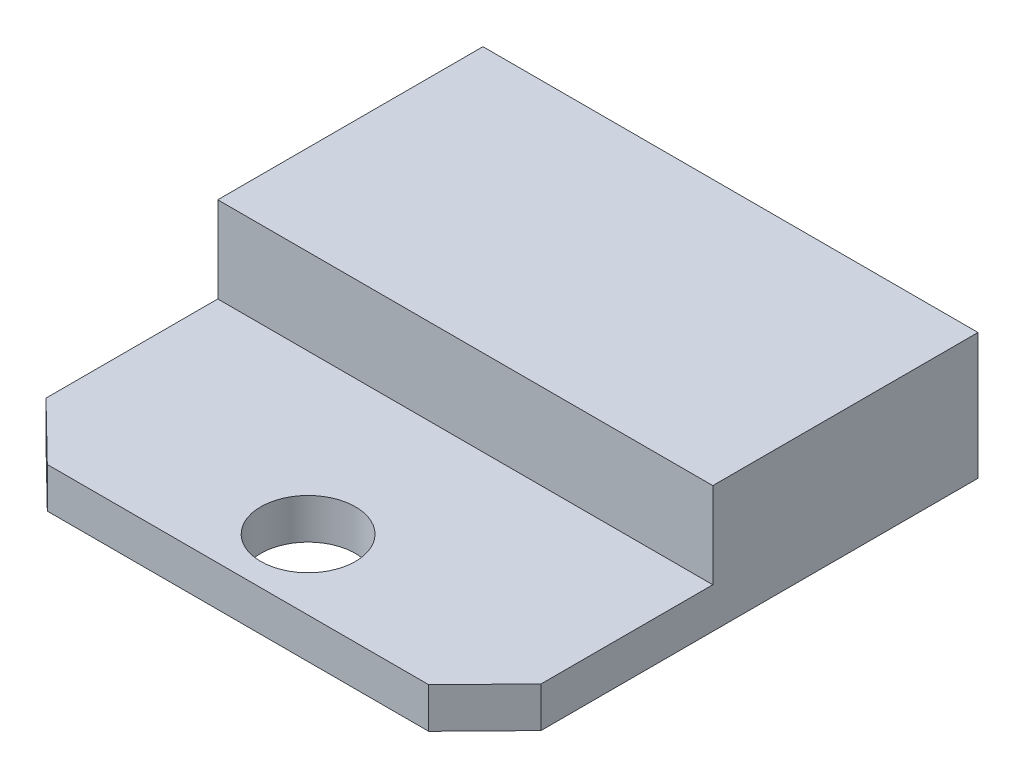
from build123d import *

# Parameters (mm, degrees)
SKETCH_1_R      = 1.875
EXTRUDE_1_DEPTH = 1.6
SKETCH_1_3_W    = 19.6
SKETCH_1_3_H    = 10.5
EXTRUDE_2_DEPTH = 5


with BuildPart() as part:
    # 草图1 → 凸台-拉伸1 (new body)
    with BuildSketch(Plane(origin=(0, 0, 0), x_dir=(1, 0, 0), z_dir=(0, 1, 0))):
        Polygon((-9.405761269, -5.514899143), (-9.405761269, -12.314899143), (-7.103957265, -14.564899143), (7.996042735, -14.564899143), (10.194238731, -12.314899143), (10.194238731, -5.514899143), align=None)
        with Locations((0.446042735, -11.789899143)):
            Circle(SKETCH_1_R, mode=Mode.SUBTRACT)
    extrude(amount=EXTRUDE_1_DEPTH)

    # 草图1<3> → 凸台-拉伸2 (add)
    with BuildSketch(Plane(origin=(0, 0, 0), x_dir=(1, 0, 0), z_dir=(0, 1, 0))):
        with Locations((0.394238731, -0.264899143)):
            Rectangle(SKETCH_1_3_W, SKETCH_1_3_H)
    extrude(amount=EXTRUDE_2_DEPTH)


solid = part.part
